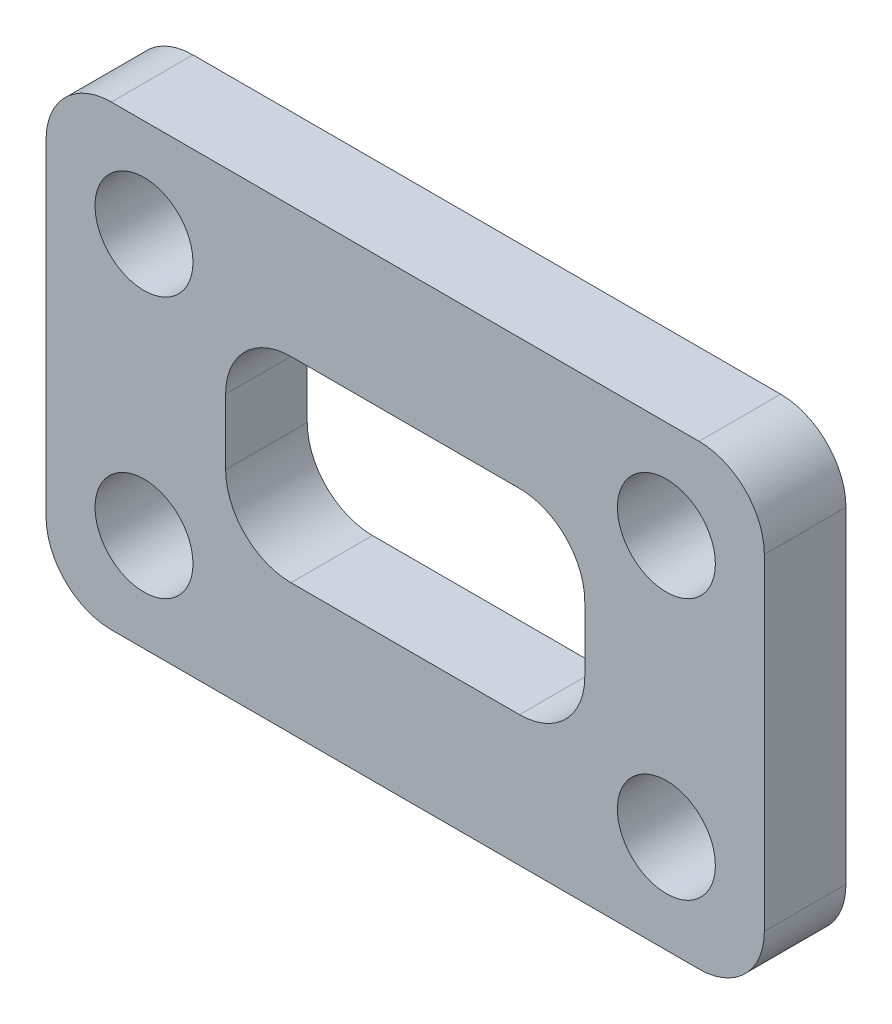
from build123d import *

# Parameters (mm, degrees)
SKETCH_1_W      = 22
SKETCH_1_H      = 14
SKETCH_1_R      = 1.5
SKETCH_1_W_2    = 11
SKETCH_1_H_2    = 6
EXTRUDE_1_DEPTH = 2.5
FILLET_1_R      = 2


with BuildPart() as part:
    # 草图1 → 凸台-拉伸1 (new body)
    with BuildSketch(Plane.XY):
        Rectangle(SKETCH_1_W, SKETCH_1_H)
        with Locations((8, 4)):
            Circle(SKETCH_1_R, mode=Mode.SUBTRACT)
        with Locations((8, -4)):
            Circle(SKETCH_1_R, mode=Mode.SUBTRACT)
        with Locations((-8, -4)):
            Circle(SKETCH_1_R, mode=Mode.SUBTRACT)
        with Locations((-8, 4)):
            Circle(SKETCH_1_R, mode=Mode.SUBTRACT)
        Rectangle(SKETCH_1_W_2, SKETCH_1_H_2, mode=Mode.SUBTRACT)
    extrude(amount=EXTRUDE_1_DEPTH)

    # 圆角1
    fillet_1_edges = [part.edges().sort_by_distance(p)[0] for p in [
        (5.5, -3, 1.25),
        (5.5, 3, 1.25),
        (-5.5, 3, 1.25),
        (-5.5, -3, 1.25),
        (11, -7, 1.25),
        (-11, -7, 1.25),
        (-11, 7, 1.25),
        (11, 7, 1.25),
    ]]
    fillet(fillet_1_edges, radius=FILLET_1_R)


solid = part.part
